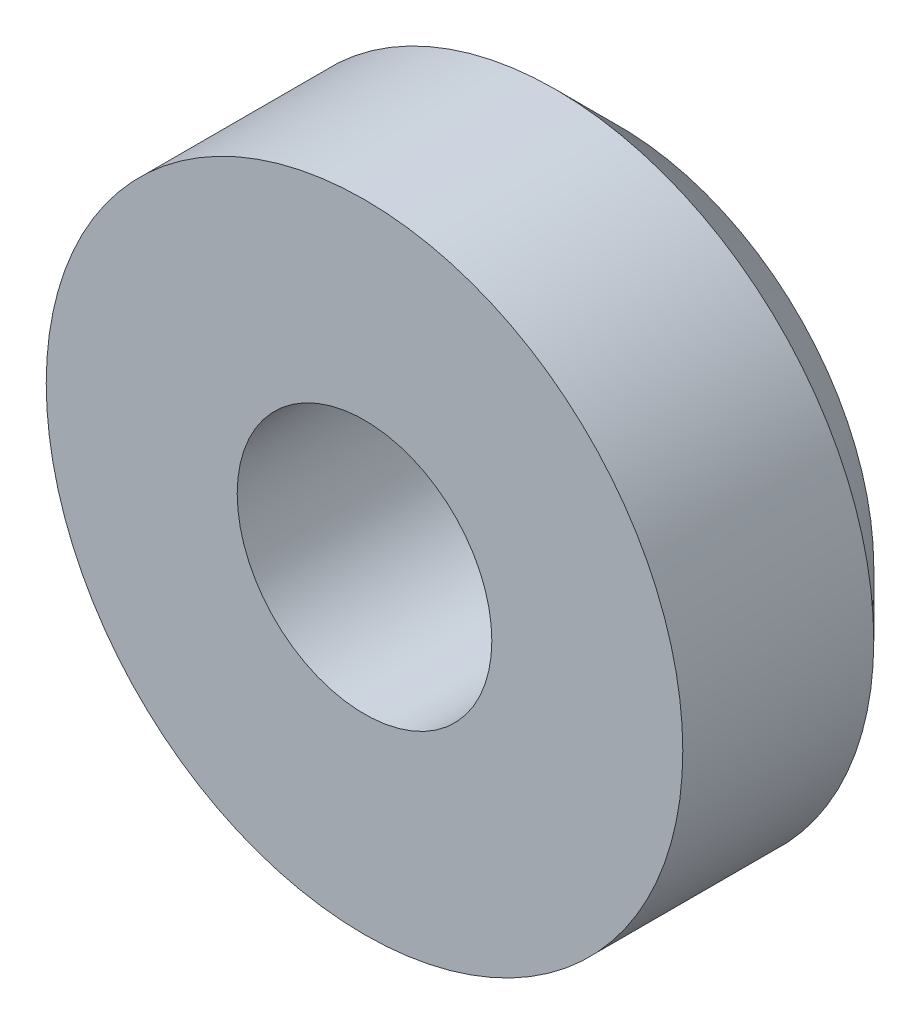
from build123d import *

# Parameters (mm, degrees)
SKETCH_1_R      = 15
EXTRUDE_1_DEPTH = 2
SKETCH_2_R      = 15
SKETCH_2_R_2    = 6
EXTRUDE_2_DEPTH = 10
CHAMFER_1_SIZE  = 3


with BuildPart() as part:
    # 草图1 → 凸台-拉伸1 (new body)
    with BuildSketch(Plane.XY):
        Circle(SKETCH_1_R)
    extrude(amount=EXTRUDE_1_DEPTH)

    # 草图2 → 凸台-拉伸2 (add)
    with BuildSketch(Plane.XY.offset(2)):
        Circle(SKETCH_2_R)
        Circle(SKETCH_2_R_2, mode=Mode.SUBTRACT)
    extrude(amount=EXTRUDE_2_DEPTH)

    # 倒角1
    chamfer_1_edges = [part.edges().sort_by_distance(p)[0] for p in [
        (-15, 0, 0),
    ]]
    chamfer(chamfer_1_edges, length=CHAMFER_1_SIZE)


solid = part.part
